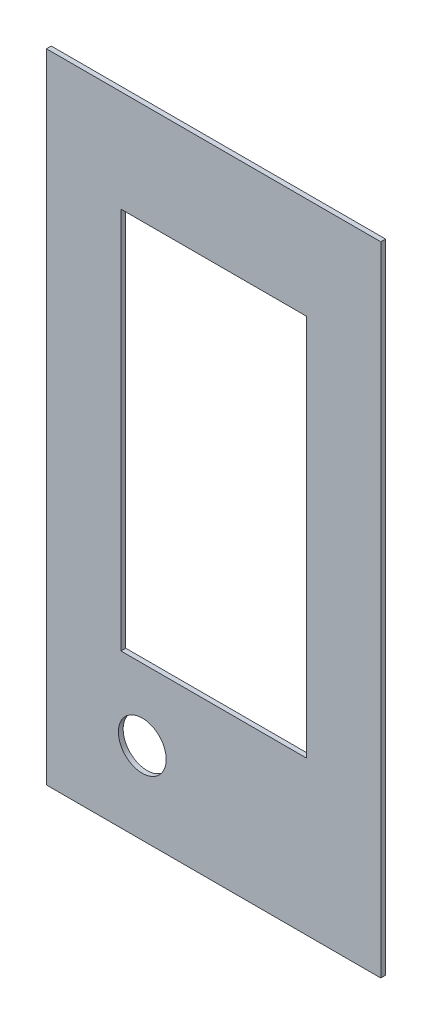
from build123d import *

# Parameters (mm, degrees)
SKETCH_1_W          = 279.576527547
SKETCH_1_H          = 4
EXTRUDE_1_DEPTH     = 533.213673317
SKETCH_2_R          = 20
CUT_EXTRUDE_1_DEPTH = 553.536377523
SKETCH1_W           = 155
SKETCH1_H           = 320
CUT_EXTRUDE1_DEPTH  = 553.536377523


with BuildPart() as part:
    # Эскиз1 → Вытянуть1 (new body)
    with BuildSketch(Plane(origin=(0, 0, 0), x_dir=(1, 0, 0), z_dir=(0, 1, 0))):
        with Locations((-4.999950783, -3.341392103)):
            Rectangle(SKETCH_1_W, SKETCH_1_H)
    extrude(amount=EXTRUDE_1_DEPTH)

    # Эскиз2 → Вырез-Вытянуть1 (cut, through all)
    with BuildSketch(Plane(origin=(0, 0, 1.341392103), x_dir=(-1, 0, 0), z_dir=(0, 0, -1))):
        with Locations((64.651566286, 68.554150891)):
            Circle(SKETCH_2_R)
    extrude(amount=-CUT_EXTRUDE_1_DEPTH, mode=Mode.SUBTRACT)

    # Sketch1 → Cut-Extrude1 (cut, through all)
    with BuildSketch(Plane(origin=(0, 0, 1.341392103), x_dir=(-1, 0, 0), z_dir=(0, 0, -1))):
        with Locations((4.999950782, 288.213673317)):
            Rectangle(SKETCH1_W, SKETCH1_H)
    extrude(amount=-CUT_EXTRUDE1_DEPTH, mode=Mode.SUBTRACT)


solid = part.part
